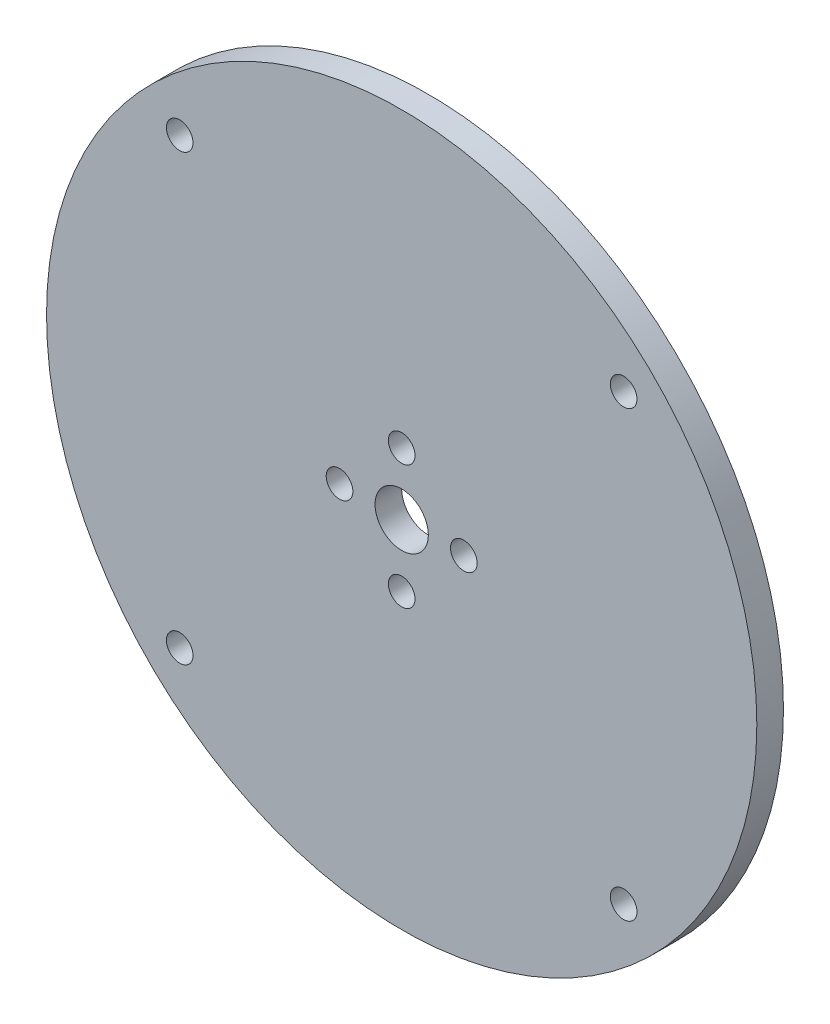
from build123d import *

# Parameters (mm, degrees)
SKETCH_1_R      = 40
SKETCH_1_R_2    = 1.5
SKETCH_1_R_3    = 3
EXTRUDE_1_DEPTH = 3


with BuildPart() as part:
    # 草图1 → 凸台-拉伸1 (new body)
    with BuildSketch(Plane.XY):
        Circle(SKETCH_1_R)
        with Locations((-25, 25)):
            Circle(SKETCH_1_R_2, mode=Mode.SUBTRACT)
        with Locations((25, 25)):
            Circle(SKETCH_1_R_2, mode=Mode.SUBTRACT)
        with Locations((25, -25)):
            Circle(SKETCH_1_R_2, mode=Mode.SUBTRACT)
        with Locations((-25, -25)):
            Circle(SKETCH_1_R_2, mode=Mode.SUBTRACT)
        Circle(SKETCH_1_R_3, mode=Mode.SUBTRACT)
        with Locations((0, 7)):
            Circle(SKETCH_1_R_2, mode=Mode.SUBTRACT)
        with Locations((-7, 0)):
            Circle(SKETCH_1_R_2, mode=Mode.SUBTRACT)
        with Locations((7, 0)):
            Circle(SKETCH_1_R_2, mode=Mode.SUBTRACT)
        with Locations((0, -7)):
            Circle(SKETCH_1_R_2, mode=Mode.SUBTRACT)
    extrude(amount=EXTRUDE_1_DEPTH)


solid = part.part
